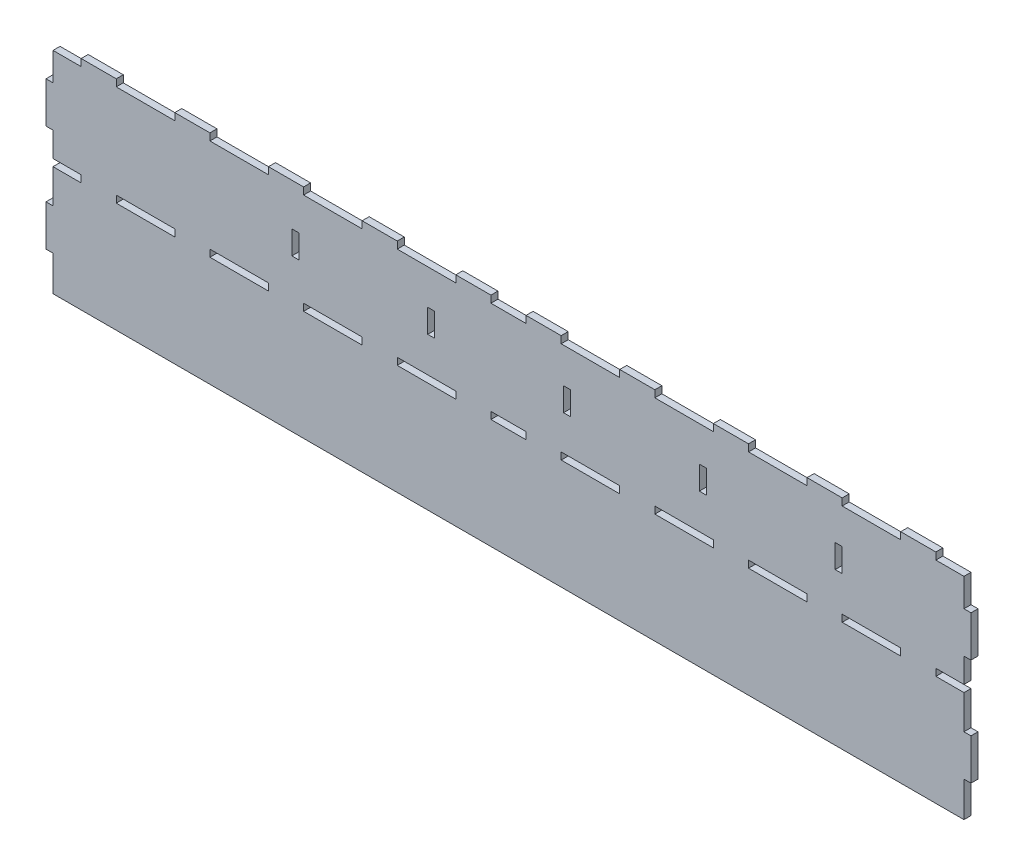
from build123d import *

# Parameters (mm, degrees)
SKETCH1_W           = 790
SKETCH1_H           = 180
BOSS_EXTRUDE1_DEPTH = 6
SKETCH2_W           = 50
SKETCH2_H           = 6
SKETCH2_W_2         = 30
CUT_EXTRUDE1_DEPTH  = 10
SKETCH3_W           = 6
SKETCH3_H           = 20
CUT_EXTRUDE2_DEPTH  = 10
SKETCH4_W           = 30
SKETCH4_H           = 6
BOSS_EXTRUDE2_DEPTH = 6
SKETCH5_W           = 6
SKETCH5_H           = 30
SKETCH5_H_2         = 29
SKETCH5_H_3         = 24
SKETCH5_H_4         = 21
CUT_EXTRUDE3_DEPTH  = 6


with BuildPart() as part:
    # Sketch1 → Boss-Extrude1 (new body)
    with BuildSketch(Plane.XY):
        Rectangle(SKETCH1_W, SKETCH1_H)
    extrude(amount=BOSS_EXTRUDE1_DEPTH)

    # Sketch2 → Cut-Extrude1 (cut)
    with BuildSketch(Plane.XY.offset(6)):
        with Locations((150, 7)):
            Rectangle(SKETCH2_W, SKETCH2_H)
        with Locations((0, 7)):
            Rectangle(SKETCH2_W_2, SKETCH2_H)
        with Locations((70, 7)):
            Rectangle(SKETCH2_W, SKETCH2_H)
        with Locations((230, 7)):
            Rectangle(SKETCH2_W, SKETCH2_H)
        with Locations((310, 7)):
            Rectangle(SKETCH2_W, SKETCH2_H)
        with Locations((390, 7)):
            Rectangle(SKETCH2_W, SKETCH2_H)
        with Locations((-390, 7)):
            Rectangle(SKETCH2_W, SKETCH2_H)
        with Locations((-310, 7)):
            Rectangle(SKETCH2_W, SKETCH2_H)
        with Locations((-230, 7)):
            Rectangle(SKETCH2_W, SKETCH2_H)
        with Locations((-150, 7)):
            Rectangle(SKETCH2_W, SKETCH2_H)
        with Locations((-70, 7)):
            Rectangle(SKETCH2_W, SKETCH2_H)
    extrude(amount=-CUT_EXTRUDE1_DEPTH, mode=Mode.SUBTRACT)

    # Sketch3 → Cut-Extrude2 (cut)
    with BuildSketch(Plane.XY.offset(6)):
        with Locations((-66, 50)):
            Rectangle(SKETCH3_W, SKETCH3_H)
        with Locations((-182, 50)):
            Rectangle(SKETCH3_W, SKETCH3_H)
        with Locations((50, 50)):
            Rectangle(SKETCH3_W, SKETCH3_H)
        with Locations((166, 50)):
            Rectangle(SKETCH3_W, SKETCH3_H)
        with Locations((282, 50)):
            Rectangle(SKETCH3_W, SKETCH3_H)
    extrude(amount=-CUT_EXTRUDE2_DEPTH, mode=Mode.SUBTRACT)

    # Sketch4 → Boss-Extrude2 (add)
    with BuildSketch(Plane.XY.offset(6)):
        with Locations((110, 93)):
            Rectangle(SKETCH4_W, SKETCH4_H)
        with Locations((30, 93)):
            Rectangle(SKETCH4_W, SKETCH4_H)
        with Locations((190, 93)):
            Rectangle(SKETCH4_W, SKETCH4_H)
        with Locations((270, 93)):
            Rectangle(SKETCH4_W, SKETCH4_H)
        with Locations((350, 93)):
            Rectangle(SKETCH4_W, SKETCH4_H)
        with Locations((-350, 93)):
            Rectangle(SKETCH4_W, SKETCH4_H)
        with Locations((-270, 93)):
            Rectangle(SKETCH4_W, SKETCH4_H)
        with Locations((-190, 93)):
            Rectangle(SKETCH4_W, SKETCH4_H)
        with Locations((-30, 93)):
            Rectangle(SKETCH4_W, SKETCH4_H)
        with Locations((-110, 93)):
            Rectangle(SKETCH4_W, SKETCH4_H)
    extrude(amount=-BOSS_EXTRUDE2_DEPTH)

    # Sketch5 → Cut-Extrude3 (cut)
    with BuildSketch(Plane.XY.offset(6)):
        with Locations((392, -75)):
            Rectangle(SKETCH5_W, SKETCH5_H)
        with Locations((392, -10.5)):
            Rectangle(SKETCH5_W, SKETCH5_H_2)
        with Locations((392, 78)):
            Rectangle(SKETCH5_W, SKETCH5_H_3)
        with Locations((392, 20.5)):
            Rectangle(SKETCH5_W, SKETCH5_H_4)
        with Locations((-392, 20.5)):
            Rectangle(SKETCH5_W, SKETCH5_H_4)
        with Locations((-392, 78)):
            Rectangle(SKETCH5_W, SKETCH5_H_3)
        with Locations((-392, -10.5)):
            Rectangle(SKETCH5_W, SKETCH5_H_2)
        with Locations((-392, -75)):
            Rectangle(SKETCH5_W, SKETCH5_H)
    extrude(amount=-CUT_EXTRUDE3_DEPTH, mode=Mode.SUBTRACT)


solid = part.part
